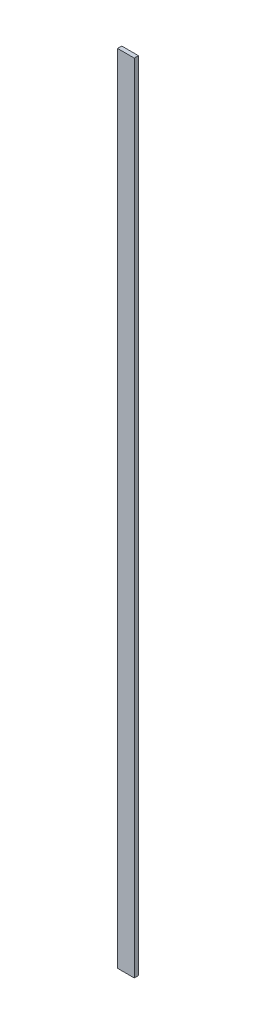
from build123d import *

# Parameters (mm, degrees)
BOSS_EXTRUDE2_DEPTH = 1.5875


with BuildPart() as part:
    # Sketch1 → Boss-Extrude2 (new body)
    with BuildSketch(Plane.XY):
        Polygon((-7.619274407, -72.565960529), (-13.969274407, -72.565960529), (-13.970081974, 229.69844639), (-7.620081974, 229.69844639), align=None)
    extrude(amount=BOSS_EXTRUDE2_DEPTH)


solid = part.part
